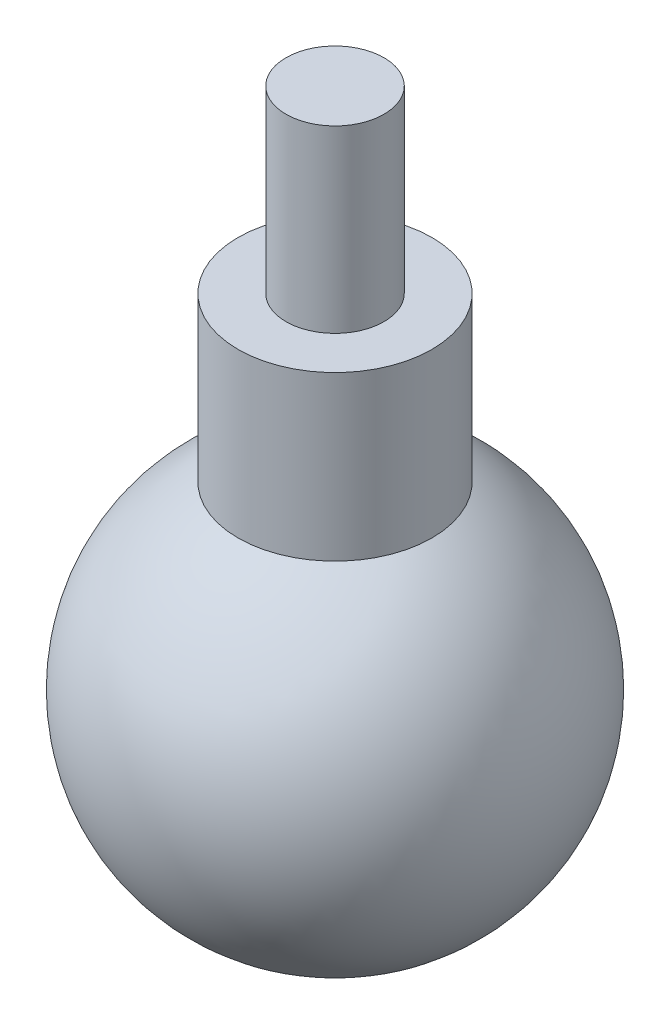
from build123d import *

# Parameters (mm, degrees)
ESQUISSE4_OUTSIDE_W     = 35.66
ESQUISSE4_OUTSIDE_H     = 35.66
ESQUISSE4_OUTSIDE_W_2   = 31.580909768
ESQUISSE4_OUTSIDE_H_2   = 22
ENL_V_MAT_EXTRU_1_DEPTH = 10
ESQUISSE5_R             = 5.937171044
BOSS_EXTRU_1_DEPTH      = 10
ESQUISSE6_R             = 3
BOSS_EXTRU_2_DEPTH      = 11


with BuildPart() as part:
    # Esquisse1 → Révolution1 (revolve)
    with BuildSketch(Plane.XY):
        with BuildLine():
            Line((0, -23.183892617), (0, 1.816107383))
            ThreePointArc((0, 1.816107383), (-12.5, -10.683892617), (0, -23.183892617))
        make_face()
    revolve(axis=Axis((0, -23.183892617, 0), (0, 1, 0)))

    # Esquisse4 outside → Enlèv. mat.-Extru.1 (cut)
    with BuildSketch(Plane.XY):
        with Locations((0, -10.684)):
            Rectangle(ESQUISSE4_OUTSIDE_W, ESQUISSE4_OUTSIDE_H)
        with Locations((-0.692114094, -10.683892617)):
            Rectangle(ESQUISSE4_OUTSIDE_W_2, ESQUISSE4_OUTSIDE_H_2, mode=Mode.SUBTRACT)
    enl_v_mat_extru_1 = extrude(amount=-ENL_V_MAT_EXTRU_1_DEPTH, mode=Mode.SUBTRACT)

    # Symétrie1: Enlèv. mat.-Extru.1 across plane
    add(enl_v_mat_extru_1.mirror(Plane.XY), mode=Mode.SUBTRACT)

    # Esquisse5 → Boss.-Extru.1 (add)
    with BuildSketch(Plane(origin=(0, 0.316107383, 0), x_dir=(1, 0, 0), z_dir=(0, 1, 0))):
        with Locations(Location((0, 0, 0), (0, 0, 180))):
            Circle(ESQUISSE5_R)
    extrude(amount=BOSS_EXTRU_1_DEPTH)

    # Esquisse6 → Boss.-Extru.2 (add)
    with BuildSketch(Plane(origin=(0, 10.316107383, 0), x_dir=(1, 0, 0), z_dir=(0, 1, 0))):
        with Locations(Location((0, 0, 0), (0, 0, 180))):
            Circle(ESQUISSE6_R)
    extrude(amount=BOSS_EXTRU_2_DEPTH)


solid = part.part
